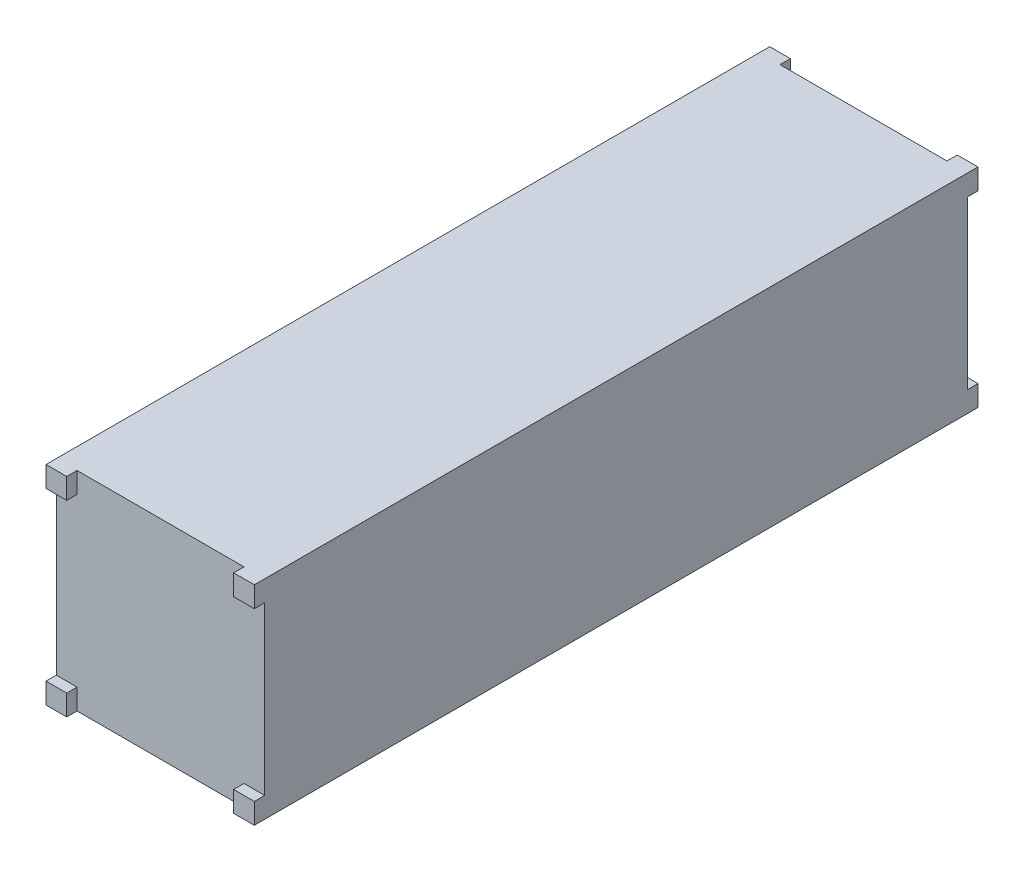
from build123d import *

# Parameters (mm, degrees)
SKETCH1_W           = 100.6
SKETCH1_H           = 100.6
BOSS_EXTRUDE1_DEPTH = 169.75
SKETCH2_W           = 10
SKETCH2_H           = 10
BOSS_EXTRUDE2_DEPTH = 5
SKETCH3_W           = 10
SKETCH3_H           = 10
BOSS_EXTRUDE3_DEPTH = 5


with BuildPart() as part:
    # Sketch1 → Boss-Extrude1 (new, symmetric)
    with BuildSketch(Plane.XY):
        Rectangle(SKETCH1_W, SKETCH1_H)
    extrude(amount=BOSS_EXTRUDE1_DEPTH, both=True)

    # Sketch2 → Boss-Extrude2 (add)
    with BuildSketch(Plane.XY.offset(169.75)):
        with Locations((-45.3, 45.3)):
            Rectangle(SKETCH2_W, SKETCH2_H)
        with Locations((45.3, 45.3)):
            Rectangle(SKETCH2_W, SKETCH2_H)
        with Locations((45.3, -45.3)):
            Rectangle(SKETCH2_W, SKETCH2_H)
        with Locations((-45.3, -45.3)):
            Rectangle(SKETCH2_W, SKETCH2_H)
    extrude(amount=BOSS_EXTRUDE2_DEPTH)

    # Sketch3 → Boss-Extrude3 (add)
    with BuildSketch(Plane(origin=(0, 0, -169.75), x_dir=(-1, 0, 0), z_dir=(0, 0, -1))):
        with Locations((-45.3, 45.3)):
            Rectangle(SKETCH3_W, SKETCH3_H)
        with Locations((45.3, 45.3)):
            Rectangle(SKETCH3_W, SKETCH3_H)
        with Locations((45.3, -45.3)):
            Rectangle(SKETCH3_W, SKETCH3_H)
        with Locations((-45.3, -45.3)):
            Rectangle(SKETCH3_W, SKETCH3_H)
    extrude(amount=BOSS_EXTRUDE3_DEPTH)


solid = part.part
